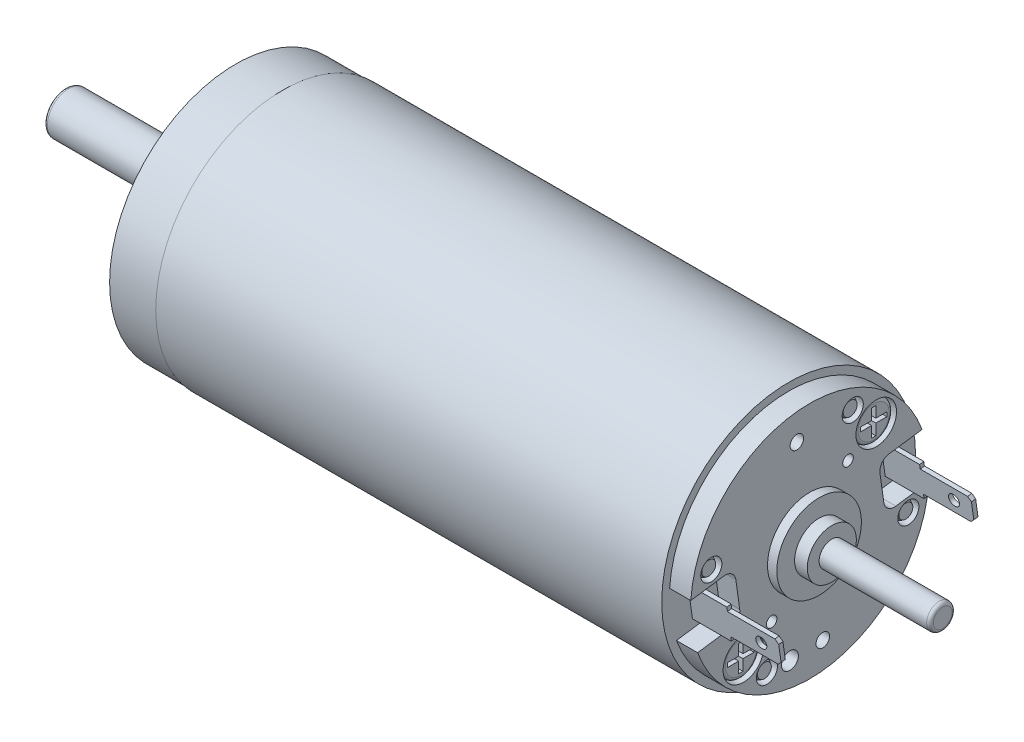
from build123d import *
from OCP.BRepFilletAPI import BRepFilletAPI_MakeChamfer

# Parameters (mm, degrees)
SKETCH1_W                        = 59.8
SKETCH1_H                        = 15
BOSS_EXTRUDE1_DEPTH              = 10.6
SKETCH3_W                        = 6
SKETCH3_H                        = 0.5
CUT_EXTRUDE1_DEPTH               = 83.152047417
SKETCH4_W                        = 6
SKETCH4_H                        = 0.5
CUT_EXTRUDE2_DEPTH               = 83.152047417
BOSS_EXTRUDE2_DEPTH              = 10.6
SKETCH6_W                        = 6
SKETCH6_H                        = 0.5
CUT_EXTRUDE3_DEPTH               = 83.152047417
SKETCH7_W                        = 6
SKETCH7_H                        = 0.5
CUT_EXTRUDE4_DEPTH               = 83.152047417
SKETCH8_R                        = 14.9
BOSS_EXTRUDE3_DEPTH              = 5.55
SKETCH9_R                        = 13.5
BOSS_EXTRUDE4_DEPTH              = 0.15
SKETCH10_R                       = 8
BOSS_EXTRUDE5_DEPTH              = 1.1
SKETCH11_R                       = 4.5
BOSS_EXTRUDE6_DEPTH              = 2.15
SKETCH12_R                       = 2.5
BOSS_EXTRUDE7_DEPTH              = 16.75
BOSS_EXTRUDE8_DEPTH              = 2.5
SKETCH14_R                       = 5
BOSS_EXTRUDE9_DEPTH              = 1.1
SKETCH15_R                       = 2.9
BOSS_EXTRUDE10_DEPTH             = 1.5
SKETCH16_R                       = 1.5
BOSS_EXTRUDE11_DEPTH             = 13.1
F_2_5_2_5_DIAMETER_HOLE1_D       = 2.5
F_2_5_2_5_DIAMETER_HOLE1_DEPTH   = 1.3
SKETCH19_R                       = 1
BOSS_EXTRUDE12_DEPTH             = 1
F_2_5_2_5_DIAMETER_HOLE2_D       = 2.5
F_2_5_2_5_DIAMETER_HOLE2_DEPTH   = 1.3
SKETCH22_R                       = 1
BOSS_EXTRUDE13_DEPTH             = 1
F_2_5_2_5_DIAMETER_HOLE3_D       = 2.5
F_2_5_2_5_DIAMETER_HOLE3_DEPTH   = 1.3
SKETCH25_R                       = 1
BOSS_EXTRUDE14_DEPTH             = 1
F_2_5_2_5_DIAMETER_HOLE4_D       = 2.5
F_2_5_2_5_DIAMETER_HOLE4_DEPTH   = 1.3
SKETCH28_R                       = 1
BOSS_EXTRUDE15_DEPTH             = 1
F_4_8_4_8_DIAMETER_HOLE1_D       = 4.8
F_4_8_4_8_DIAMETER_HOLE1_DEPTH   = 2.1
SKETCH31_R                       = 2.25
BOSS_EXTRUDE16_DEPTH             = 1.8
CUT_EXTRUDE5_DEPTH               = 1.2
F_4_8_4_8_DIAMETER_HOLE2_D       = 4.8
F_4_8_4_8_DIAMETER_HOLE2_DEPTH   = 2.1
SKETCH35_R                       = 2.25
BOSS_EXTRUDE17_DEPTH             = 1.8
CUT_EXTRUDE6_DEPTH               = 1.2
F_1_3_1_3_DIAMETER_HOLE1_D       = 1.3
F_1_3_1_3_DIAMETER_HOLE1_DEPTH   = 5.691617546
F_1_3_1_3_DIAMETER_HOLE2_D       = 1.3
F_1_3_1_3_DIAMETER_HOLE2_DEPTH   = 5.691617546
F_2_0_2_DIAMETER_HOLE1_D         = 2
F_2_0_2_DIAMETER_HOLE1_DEPTH     = 3.3
F_1_6_1_6_DIAMETER_HOLE1_D       = 1.6
F_1_6_1_6_DIAMETER_HOLE1_DEPTH   = 4.8
F_1_6_1_6_DIAMETER_HOLE1_TIP     = 0.461880215
F_1_25_1_25_DIAMETER_HOLE1_D     = 1.25
F_1_25_1_25_DIAMETER_HOLE1_DEPTH = 3.75
F_1_25_1_25_DIAMETER_HOLE1_TIP   = 0.360843918
F_1_5_1_5_DIAMETER_HOLE1_D       = 1.5
F_1_5_1_5_DIAMETER_HOLE1_DEPTH   = 1.5
F_1_5_1_5_DIAMETER_HOLE1_TIP     = 0.433012702
F_2_5_2_5_DIAMETER_HOLE5_D       = 2.5
F_2_5_2_5_DIAMETER_HOLE5_DEPTH   = 6.1
F_2_5_2_5_DIAMETER_HOLE5_TIP     = 0.721687836
CHAMFER1_SIZE                    = 0.4
CHAMFER2_SIZE                    = 0.173205081
CHAMFER2_SIZE2                   = 0.3
CHAMFER3_SIZE                    = 0.3
CHAMFER3_SIZE2                   = 0.173205081
FILLET1_R                        = 0.4
FILLET2_R                        = 1.25


with BuildPart() as part:
    # Sketch1 → Revolve1 (revolve)
    with BuildSketch(Plane.XY, mode=Mode.PRIVATE) as revolve1_sk:
        with Locations((35.6, 7.5)):
            Rectangle(SKETCH1_W, SKETCH1_H)
    revolve(revolve1_sk.sketch.rotate(Axis((5.7, 0, 0), (1, 0, 0)), 270), axis=Axis((5.7, 0, 0), (1, 0, 0)))

    # Sketch2 → Boss-Extrude1 (add)
    with BuildSketch(Plane(origin=(65.5, 0, 0), x_dir=(0, 0, -1), z_dir=(1, 0, 0))):
        Polygon((11.9000787, -0.246225394), (11.404944665, -0.315811945), (10.876086882, 3.447206716), (11.371220916, 3.516793267), align=None)
    extrude(amount=BOSS_EXTRUDE1_DEPTH)

    # Sketch3 → Cut-Extrude1 (cut, through all)
    with BuildSketch(Plane(origin=(0, 1.565697386, -11.140515773), x_dir=(1, 0, 0), z_dir=(0, -0.13917310096021315, 0.9902680687415497))):
        with Locations((73.1, 1.65)):
            Rectangle(SKETCH3_W, SKETCH3_H)
    extrude(amount=-CUT_EXTRUDE1_DEPTH, mode=Mode.SUBTRACT)

    # Sketch4 → Cut-Extrude2 (cut, through all)
    with BuildSketch(Plane(origin=(0, 1.565697386, -11.140515773), x_dir=(1, 0, 0), z_dir=(0, -0.13917310096021315, 0.9902680687415497))):
        with Locations((73.1, -1.65)):
            Rectangle(SKETCH4_W, SKETCH4_H)
    extrude(amount=-CUT_EXTRUDE2_DEPTH, mode=Mode.SUBTRACT)

    # Sketch5 → Boss-Extrude2 (add)
    with BuildSketch(Plane(origin=(65.5, 0, 0), x_dir=(0, 0, -1), z_dir=(1, 0, 0))):
        Polygon((-11.9000787, 0.246225394), (-11.404944665, 0.315811945), (-10.876086882, -3.447206716), (-11.371220916, -3.516793267), align=None)
    extrude(amount=BOSS_EXTRUDE2_DEPTH)

    # Sketch6 → Cut-Extrude3 (cut, through all)
    with BuildSketch(Plane(origin=(0, -1.565697386, 11.140515773), x_dir=(-1, 0, 0), z_dir=(0, 0.13917310096021268, -0.9902680687415497))):
        with Locations((-73.1, -1.65)):
            Rectangle(SKETCH6_W, SKETCH6_H)
    extrude(amount=-CUT_EXTRUDE3_DEPTH, mode=Mode.SUBTRACT)

    # Sketch7 → Cut-Extrude4 (cut, through all)
    with BuildSketch(Plane(origin=(0, -1.565697386, 11.140515773), x_dir=(-1, 0, 0), z_dir=(0, 0.13917310096021268, -0.9902680687415497))):
        with Locations((-73.1, 1.65)):
            Rectangle(SKETCH7_W, SKETCH7_H)
    extrude(amount=-CUT_EXTRUDE4_DEPTH, mode=Mode.SUBTRACT)

    # Sketch8 → Boss-Extrude3 (add)
    with BuildSketch(Plane.ZY.offset(-5.7)):
        Circle(SKETCH8_R)
    extrude(amount=BOSS_EXTRUDE3_DEPTH)

    # Sketch9 → Boss-Extrude4 (add)
    with BuildSketch(Plane.ZY.offset(-0.15)):
        Circle(SKETCH9_R)
    extrude(amount=BOSS_EXTRUDE4_DEPTH)

    # Sketch10 → Boss-Extrude5 (add)
    with BuildSketch(Plane.ZY):
        Circle(SKETCH10_R)
    extrude(amount=BOSS_EXTRUDE5_DEPTH)

    # Sketch11 → Boss-Extrude6 (add)
    with BuildSketch(Plane.ZY.offset(1.1)):
        with Locations(Location((0, 0, 0), (0, 0, 180))):
            Circle(SKETCH11_R)
    extrude(amount=BOSS_EXTRUDE6_DEPTH)

    # Sketch12 → Boss-Extrude7 (add)
    with BuildSketch(Plane.ZY.offset(3.25)):
        Circle(SKETCH12_R)
    extrude(amount=BOSS_EXTRUDE7_DEPTH)

    # Sketch13 → Boss-Extrude8 (add)
    with BuildSketch(Plane(origin=(65.5, 0, 0), x_dir=(0, 0, -1), z_dir=(1, 0, 0))):
        with BuildLine():
            Line((-8.919907384, 1.674888731), (-14.067866095, 0.951390317))
            ThreePointArc((-14.067866095, 0.951390317), (-1.962340724, 13.962779769), (13.260662109, 4.792164482))
            Line((13.260662109, 4.792164482), (8.112703398, 4.068666068))
            Line((8.112703398, 4.068666068), (8.919907384, -1.674888731))
            Line((8.919907384, -1.674888731), (14.067866095, -0.951390317))
            ThreePointArc((14.067866095, -0.951390317), (1.962340724, -13.962779769), (-13.260662109, -4.792164482))
            Line((-13.260662109, -4.792164482), (-8.112703398, -4.068666068))
            Line((-8.112703398, -4.068666068), (-8.919907384, 1.674888731))
        make_face()
    extrude(amount=BOSS_EXTRUDE8_DEPTH)

    # Sketch14 → Boss-Extrude9 (add)
    with BuildSketch(Plane(origin=(68, 0, 0), x_dir=(0, 0, -1), z_dir=(1, 0, 0))):
        with Locations(Location((0, 0, 0), (0, 0, 180))):
            Circle(SKETCH14_R)
    extrude(amount=BOSS_EXTRUDE9_DEPTH)

    # Sketch15 → Boss-Extrude10 (add)
    with BuildSketch(Plane(origin=(69.1, 0, 0), x_dir=(0, 0, -1), z_dir=(1, 0, 0))):
        Circle(SKETCH15_R)
    extrude(amount=BOSS_EXTRUDE10_DEPTH)

    # Sketch16 → Boss-Extrude11 (add)
    with BuildSketch(Plane(origin=(70.6, 0, 0), x_dir=(0, 0, -1), z_dir=(1, 0, 0))):
        Circle(SKETCH16_R)
    extrude(amount=BOSS_EXTRUDE11_DEPTH)

    # Ø2.5 (2.5) Diameter Hole1
    with Locations(Plane(origin=(68, 0, 0), x_dir=(0, 0, -1), z_dir=(1, 0, 0))):
        with Locations((11.643548715, -2.903062747)):
            Hole(F_2_5_2_5_DIAMETER_HOLE1_D / 2, depth=F_2_5_2_5_DIAMETER_HOLE1_DEPTH)

    # Sketch19 → Boss-Extrude12 (add)
    with BuildSketch(Plane(origin=(66.7, 0, 0), x_dir=(0, 0, -1), z_dir=(1, 0, 0))):
        with Locations(Location((11.643548715, -2.903062747, 0), (0, 0, 180))):
            Circle(SKETCH19_R)
    extrude(amount=BOSS_EXTRUDE12_DEPTH)

    # Ø2.5 (2.5) Diameter Hole2
    with Locations(Plane(origin=(68, 0, 0), x_dir=(0, 0, -1), z_dir=(1, 0, 0))):
        with Locations((5.071419141, 10.875693444)):
            Hole(F_2_5_2_5_DIAMETER_HOLE2_D / 2, depth=F_2_5_2_5_DIAMETER_HOLE2_DEPTH)

    # Sketch22 → Boss-Extrude13 (add)
    with BuildSketch(Plane(origin=(66.7, 0, 0), x_dir=(0, 0, -1), z_dir=(1, 0, 0))):
        with Locations(Location((5.071419141, 10.875693444, 0), (0, 0, 180))):
            Circle(SKETCH22_R)
    extrude(amount=BOSS_EXTRUDE13_DEPTH)

    # Ø2.5 (2.5) Diameter Hole3
    with Locations(Plane(origin=(68, 0, 0), x_dir=(0, 0, -1), z_dir=(1, 0, 0))):
        with Locations((-11.643548715, 2.903062747)):
            Hole(F_2_5_2_5_DIAMETER_HOLE3_D / 2, depth=F_2_5_2_5_DIAMETER_HOLE3_DEPTH)

    # Sketch25 → Boss-Extrude14 (add)
    with BuildSketch(Plane(origin=(66.7, 0, 0), x_dir=(0, 0, -1), z_dir=(1, 0, 0))):
        with Locations(Location((-11.643548715, 2.903062747, 0), (0, 0, 180))):
            Circle(SKETCH25_R)
    extrude(amount=BOSS_EXTRUDE14_DEPTH)

    # Ø2.5 (2.5) Diameter Hole4
    with Locations(Plane(origin=(68, 0, 0), x_dir=(0, 0, -1), z_dir=(1, 0, 0))):
        with Locations((-5.071419141, -10.875693444)):
            Hole(F_2_5_2_5_DIAMETER_HOLE4_D / 2, depth=F_2_5_2_5_DIAMETER_HOLE4_DEPTH)

    # Sketch28 → Boss-Extrude15 (add)
    with BuildSketch(Plane(origin=(66.7, 0, 0), x_dir=(0, 0, -1), z_dir=(1, 0, 0))):
        with Locations(Location((-5.071419141, -10.875693444, 0), (0, 0, 180))):
            Circle(SKETCH28_R)
    extrude(amount=BOSS_EXTRUDE15_DEPTH)

    # Ø4.8 (4.8) Diameter Hole1
    with Locations(Plane(origin=(68, 0, 0), x_dir=(0, 0, -1), z_dir=(1, 0, 0))):
        with Locations((7.849639586, 8.128539744)):
            Hole(F_4_8_4_8_DIAMETER_HOLE1_D / 2, depth=F_4_8_4_8_DIAMETER_HOLE1_DEPTH)

    # Sketch31 → Boss-Extrude16 (add)
    with BuildSketch(Plane(origin=(65.9, 0, 0), x_dir=(0, 0, -1), z_dir=(1, 0, 0))):
        with Locations(Location((7.849639586, 8.128539744, 0), (0, 0, 180))):
            Circle(SKETCH31_R)
    extrude(amount=BOSS_EXTRUDE16_DEPTH)

    # Sketch32 → Cut-Extrude5 (cut)
    with BuildSketch(Plane(origin=(67.7, 0, 0), x_dir=(0, 0, -1), z_dir=(1, 0, 0))):
        Polygon((7.599639586, 8.378539744), (6.299639586, 8.378539744), (6.299639586, 7.878539744), (7.599639586, 7.878539744), (7.599639586, 6.578539744), (8.099639586, 6.578539744), (8.099639586, 7.878539744), (9.399639586, 7.878539744), (9.399639586, 8.378539744), (8.099639586, 8.378539744), (8.099639586, 9.678539744), (7.599639586, 9.678539744), align=None)
    extrude(amount=-CUT_EXTRUDE5_DEPTH, mode=Mode.SUBTRACT)

    # Ø4.8 (4.8) Diameter Hole2
    with Locations(Plane(origin=(68, 0, 0), x_dir=(0, 0, -1), z_dir=(1, 0, 0))):
        with Locations((-7.849639586, -8.128539744)):
            Hole(F_4_8_4_8_DIAMETER_HOLE2_D / 2, depth=F_4_8_4_8_DIAMETER_HOLE2_DEPTH)

    # Sketch35 → Boss-Extrude17 (add)
    with BuildSketch(Plane(origin=(65.9, 0, 0), x_dir=(0, 0, -1), z_dir=(1, 0, 0))):
        with Locations(Location((-7.849639586, -8.128539744, 0), (0, 0, 180))):
            Circle(SKETCH35_R)
    extrude(amount=BOSS_EXTRUDE17_DEPTH)

    # Sketch36 → Cut-Extrude6 (cut)
    with BuildSketch(Plane(origin=(67.7, 0, 0), x_dir=(0, 0, -1), z_dir=(1, 0, 0))):
        Polygon((-8.099639586, -7.878539744), (-9.399639586, -7.878539744), (-9.399639586, -8.378539744), (-8.099639586, -8.378539744), (-8.099639586, -9.678539744), (-7.599639586, -9.678539744), (-7.599639586, -8.378539744), (-6.299639586, -8.378539744), (-6.299639586, -7.878539744), (-7.599639586, -7.878539744), (-7.599639586, -6.578539744), (-8.099639586, -6.578539744), align=None)
    extrude(amount=-CUT_EXTRUDE6_DEPTH, mode=Mode.SUBTRACT)

    # Ø1.3 (1.3) Diameter Hole1
    with Locations(Plane(origin=(0, -1.565697386, 11.140515773), x_dir=(-1, 0, 0), z_dir=(0, 0.13917310096021265, -0.9902680687415496))):
        with Locations((-73.9, 0)):
            Hole(F_1_3_1_3_DIAMETER_HOLE1_D / 2, depth=F_1_3_1_3_DIAMETER_HOLE1_DEPTH)

    # Ø1.3 (1.3) Diameter Hole2
    with Locations(Plane(origin=(0, 1.565697386, -11.140515773), x_dir=(1, 0, 0), z_dir=(0, -0.13917310096021315, 0.9902680687415497))):
        with Locations((73.9, 0)):
            Hole(F_1_3_1_3_DIAMETER_HOLE2_D / 2, depth=F_1_3_1_3_DIAMETER_HOLE2_DEPTH)

    # Ø2.0 (2) Diameter Hole1
    with Locations(Plane(origin=(68, 0, 0), x_dir=(0, 0, -1), z_dir=(1, 0, 0))):
        with Locations((-2.349402106, -11.053067888)):
            Hole(F_2_0_2_DIAMETER_HOLE1_D / 2, depth=F_2_0_2_DIAMETER_HOLE1_DEPTH)

    # Ø1.6 (1.6) Diameter Hole1
    with Locations(Plane(origin=(68, 0, 0), x_dir=(0, 0, -1), z_dir=(1, 0, 0))):
        with Locations((1.530904111, -10.892948756), (-1.530904111, 10.892948756)):
            Hole(F_1_6_1_6_DIAMETER_HOLE1_D / 2, depth=F_1_6_1_6_DIAMETER_HOLE1_DEPTH)
            with Locations((0, 0, -(F_1_6_1_6_DIAMETER_HOLE1_DEPTH + F_1_6_1_6_DIAMETER_HOLE1_TIP / 2))):  # 120° drill point
                Cone(0, F_1_6_1_6_DIAMETER_HOLE1_D / 2, F_1_6_1_6_DIAMETER_HOLE1_TIP, mode=Mode.SUBTRACT)

    # Ø1.25 (1.25) Diameter Hole1
    with Locations(Plane(origin=(68, 0, 0), x_dir=(0, 0, -1), z_dir=(1, 0, 0))):
        with Locations((4.513612674, 5.989766325), (-4.513612674, -5.989766325)):
            Hole(F_1_25_1_25_DIAMETER_HOLE1_D / 2, depth=F_1_25_1_25_DIAMETER_HOLE1_DEPTH)
            with Locations((0, 0, -(F_1_25_1_25_DIAMETER_HOLE1_DEPTH + F_1_25_1_25_DIAMETER_HOLE1_TIP / 2))):  # 120° drill point
                Cone(0, F_1_25_1_25_DIAMETER_HOLE1_D / 2, F_1_25_1_25_DIAMETER_HOLE1_TIP, mode=Mode.SUBTRACT)

    # Ø1.5 (1.5) Diameter Hole1
    with Locations(Plane.ZY):
        with Locations((-6, 10.392304845)):
            Hole(F_1_5_1_5_DIAMETER_HOLE1_D / 2, depth=F_1_5_1_5_DIAMETER_HOLE1_DEPTH)
            with Locations((0, 0, -(F_1_5_1_5_DIAMETER_HOLE1_DEPTH + F_1_5_1_5_DIAMETER_HOLE1_TIP / 2))):  # 120° drill point
                Cone(0, F_1_5_1_5_DIAMETER_HOLE1_D / 2, F_1_5_1_5_DIAMETER_HOLE1_TIP, mode=Mode.SUBTRACT)

    # Ø2.5 (2.5) Diameter Hole5
    with Locations(Plane.ZY):
        with Locations((0, 11), (9.526279442, 5.5), (9.526279442, -5.5), (0, -11), (-9.526279442, -5.5), (-9.526279442, 5.5)):
            Hole(F_2_5_2_5_DIAMETER_HOLE5_D / 2, depth=F_2_5_2_5_DIAMETER_HOLE5_DEPTH)
            with Locations((0, 0, -(F_2_5_2_5_DIAMETER_HOLE5_DEPTH + F_2_5_2_5_DIAMETER_HOLE5_TIP / 2))):  # 120° drill point
                Cone(0, F_2_5_2_5_DIAMETER_HOLE5_D / 2, F_2_5_2_5_DIAMETER_HOLE5_TIP, mode=Mode.SUBTRACT)

    # Chamfer1
    chamfer1_edges = [part.edges().sort_by_distance(p)[0] for p in [
        (76.1, 2.986865957, -11.193240449),
        (76.1, 0.214115365, -11.582925132),
        (76.1, -2.986865957, 11.193240449),
        (76.1, -0.214115365, 11.582925132),
    ]]
    chamfer(chamfer1_edges, length=CHAMFER1_SIZE)

    # Chamfer2: one chamfer whose edges measure the first distance from different faces: ONE call of the kernel's chamfer builder (chamfer() names one face for all edges)
    chamfer2_edges_1 = [part.edges().sort_by_distance(p)[0] for p in [
        (67.7, -2.903062747, -12.643548715),
    ]]
    chamfer2_side_1 = [part.faces().sort_by_distance(p)[0] for p in [
        (67.7, -2.903062747, -11.643548715),
    ]]
    chamfer2_edges_2 = [part.edges().sort_by_distance(p)[0] for p in [
        (67.7, 10.875693444, -6.071419141),
    ]]
    chamfer2_side_2 = [part.faces().sort_by_distance(p)[0] for p in [
        (67.7, 10.875693444, -5.071419141),
    ]]
    chamfer2_edges_3 = [part.edges().sort_by_distance(p)[0] for p in [
        (67.7, 2.903062747, 10.643548715),
    ]]
    chamfer2_side_3 = [part.faces().sort_by_distance(p)[0] for p in [
        (67.7, 2.903062747, 11.643548715),
    ]]
    chamfer2 = BRepFilletAPI_MakeChamfer(part.part.solid().wrapped)
    for e in chamfer2_edges_1:
        chamfer2.Add(CHAMFER2_SIZE, CHAMFER2_SIZE2, e.wrapped, chamfer2_side_1[0].wrapped)  # the first distance lies on this face
    for e in chamfer2_edges_2:
        chamfer2.Add(CHAMFER2_SIZE, CHAMFER2_SIZE2, e.wrapped, chamfer2_side_2[0].wrapped)  # the first distance lies on this face
    for e in chamfer2_edges_3:
        chamfer2.Add(CHAMFER2_SIZE, CHAMFER2_SIZE2, e.wrapped, chamfer2_side_3[0].wrapped)  # the first distance lies on this face
    add(Compound.cast(chamfer2.Shape()), mode=Mode.REPLACE)

    # Chamfer3
    chamfer3_edges = [part.edges().sort_by_distance(p)[0] for p in [
        (67.7, -10.875693444, 4.071419141),
    ]]
    chamfer3_side = [part.faces().sort_by_distance(p)[0] for p in [
        (67.2, -10.875693444, 4.071419141),
    ]]
    chamfer(chamfer3_edges, length=CHAMFER3_SIZE, length2=CHAMFER3_SIZE2, reference=chamfer3_side[0])

    # Fillet1
    fillet1_edges = [part.edges().sort_by_distance(p)[0] for p in [
        (-20, 0, -2.5),
        (83.7, 0, 1.5),
        (67.7, 8.128539744, -10.099639586),
        (67.7, -8.128539744, 5.599639586),
    ]]
    fillet(fillet1_edges, radius=FILLET1_R)

    # Fillet2
    fillet2_edges = [part.edges().sort_by_distance(p)[0] for p in [
        (66.75, 1.674888731, 8.919907384),
        (66.75, -4.068666068, 8.112703398),
        (66.75, -1.674888731, -8.919907384),
        (66.75, 4.068666068, -8.112703398),
    ]]
    fillet(fillet2_edges, radius=FILLET2_R)


solid = part.part
